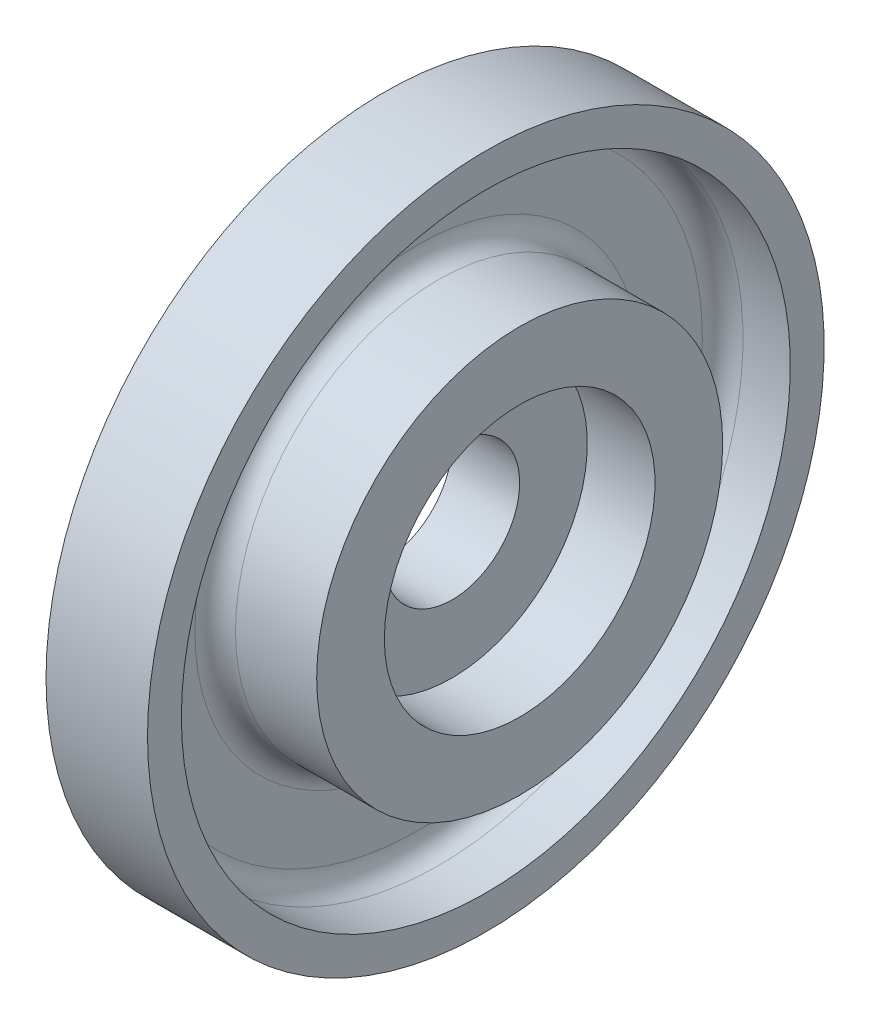
from build123d import *


with BuildPart() as part:
    # Croquis1 → Revolución1 (revolve)
    with BuildSketch(Plane.XY, mode=Mode.PRIVATE) as revoluci_n1_sk:
        with BuildLine():
            Line((0, 10), (0, 50))
            Line((0, 50), (15, 50))
            Line((15, 50), (15, 45))
            Line((15, 45), (8, 45))
            ThreePointArc((8, 45), (5.878679656, 44.121320344), (5, 42))
            Line((5, 42), (5, 33))
            ThreePointArc((5, 33), (5.878679656, 30.878679656), (8, 30))
            Line((8, 30), (20, 30))
            Line((20, 30), (20, 20))
            Line((20, 20), (10, 20))
            Line((10, 20), (10, 10))
            Line((10, 10), (0, 10))
        make_face()
    revolve(revoluci_n1_sk.sketch.rotate(Axis((-16.484758047, 0, 0), (1, 0, 0)), 90), axis=Axis((-16.484758047, 0, 0), (1, 0, 0)))


solid = part.part
